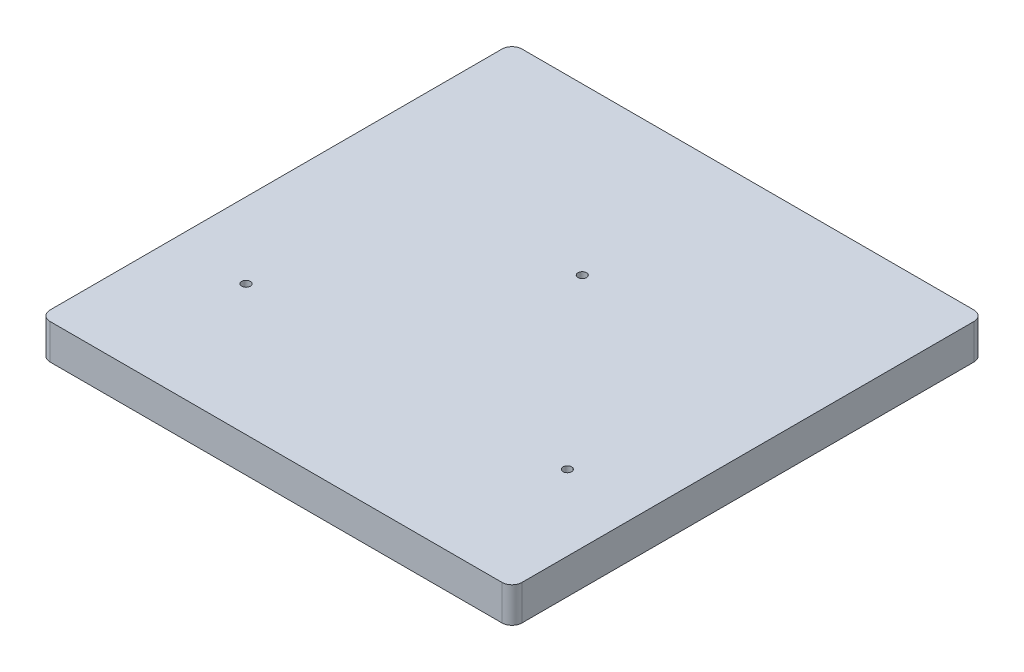
from build123d import *

# Parameters (mm, degrees)
SKETCH3_W             = 152.4
SKETCH3_H             = 11.1125
BOSS_EXTRUDE1_DEPTH   = 76.2
F_6_32_TAPPED_HOLE1_D = 2.7051
SKETCH6_OUTSIDE_W     = 197.562
SKETCH6_OUTSIDE_H     = 197.562
CUT_EXTRUDE1_DEPTH    = 109.334517381


with BuildPart() as part:
    # Sketch3 → Boss-Extrude1 (new, symmetric)
    with BuildSketch(Plane.XY):
        Rectangle(SKETCH3_W, SKETCH3_H)
    extrude(amount=BOSS_EXTRUDE1_DEPTH, both=True)

    # #6-32 Tapped Hole1 (through all)
    with Locations(Plane(origin=(0, 5.55625, 0), x_dir=(1, 0, 0), z_dir=(0, 1, 0))):
        with Locations((0, 22.223542588), (50.8, -33.30776944), (-50.8, -33.30776944)):
            Hole(F_6_32_TAPPED_HOLE1_D / 2)

    # Sketch6 outside → Cut-Extrude1 (cut, through all)
    with BuildSketch(Plane(origin=(0, 5.55625, 0), x_dir=(1, 0, 0), z_dir=(0, 1, 0))):
        Rectangle(SKETCH6_OUTSIDE_W, SKETCH6_OUTSIDE_H)
        with BuildLine():
            Line((-71.4375, -74.6125), (71.4375, -74.6125))
            ThreePointArc((71.4375, -74.6125), (73.68256403, -73.68256403), (74.6125, -71.4375))
            Line((74.6125, -71.4375), (74.6125, 71.4375))
            ThreePointArc((74.6125, 71.4375), (73.68256403, 73.68256403), (71.4375, 74.6125))
            Line((71.4375, 74.6125), (-71.4375, 74.6125))
            ThreePointArc((-71.4375, 74.6125), (-73.68256403, 73.68256403), (-74.6125, 71.4375))
            Line((-74.6125, 71.4375), (-74.6125, -71.4375))
            ThreePointArc((-74.6125, -71.4375), (-73.68256403, -73.68256403), (-71.4375, -74.6125))
        make_face(mode=Mode.SUBTRACT)
    extrude(amount=-CUT_EXTRUDE1_DEPTH, mode=Mode.SUBTRACT)


solid = part.part
